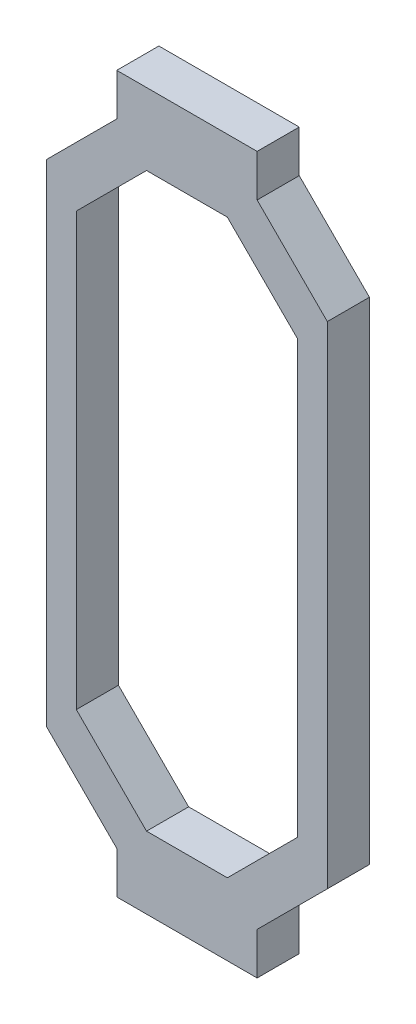
from build123d import *

# Parameters (mm, degrees)
BOSS_EXTRUDE1_DEPTH = 6


with BuildPart() as part:
    # Sketch1 → Boss-Extrude1 (new body)
    with BuildSketch(Plane.XY):
        Polygon((20, -35), (20, 35), (10, 45), (10, 51), (-10, 51), (-10, 45), (-20, 35), (-20, -35), (-10, -45), (-10, -51), (10, -51), (10, -45), align=None)
        Polygon((5.757359313, 40.757359313), (15.757359313, 30.757359313), (15.757359313, -30.757359313), (5.757359313, -40.757359313), (-5.757359313, -40.757359313), (-15.757359313, -30.757359313), (-15.757359313, 30.757359313), (-5.757359313, 40.757359313), align=None, mode=Mode.SUBTRACT)
    extrude(amount=BOSS_EXTRUDE1_DEPTH)


solid = part.part
